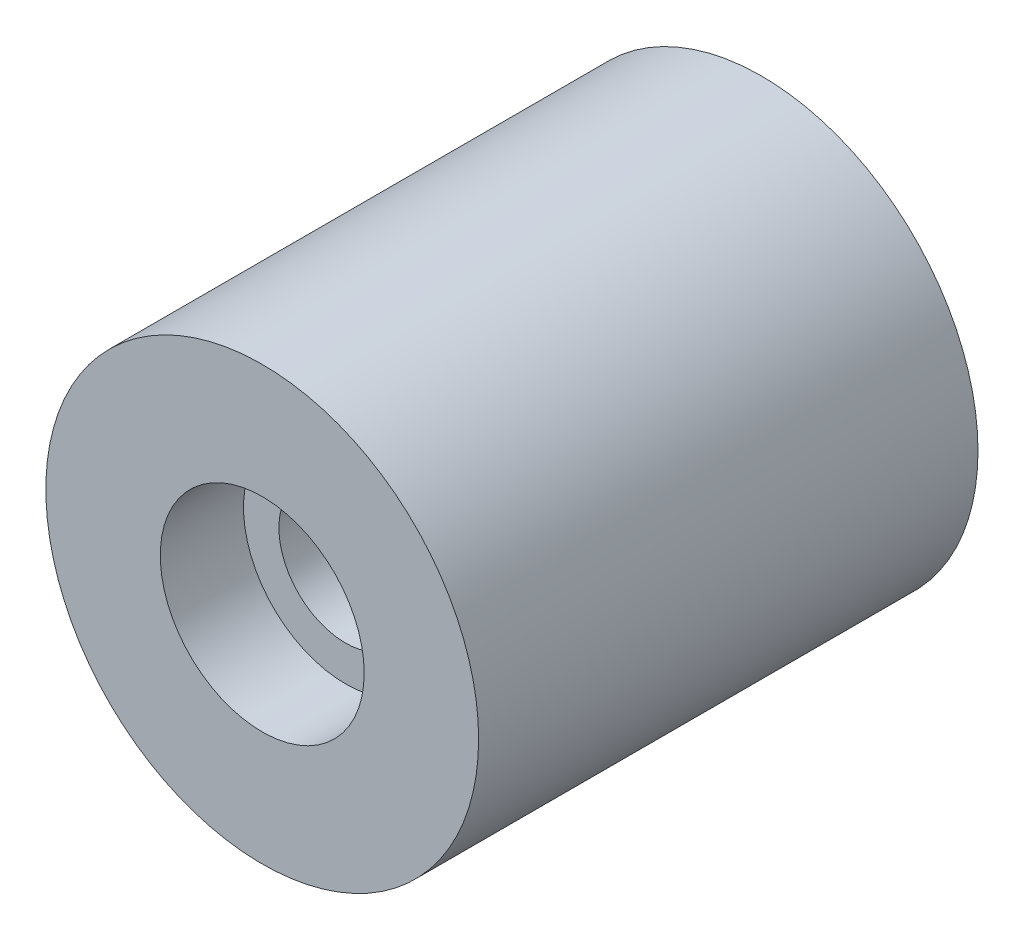
from build123d import *

# Parameters (mm, degrees)
BOSS_EXTRUDE1_DEPTH      = 7.5
BOSS_EXTRUDE1_DEPTH_BACK = 7.5
SKETCH1_R                = 6.5
SKETCH1_R_2              = 2
SKETCH2_R                = 3.0625
CUT_EXTRUDE1_DEPTH       = 2.5


with BuildPart() as part:
    # Sketch1 → Boss-Extrude1 (new, two sides: drawn at the far end of the back side and taken through both)
    with BuildSketch(Plane.XY.offset(13.5).offset(-BOSS_EXTRUDE1_DEPTH_BACK)):
        with Locations((15, 0)):
            Circle(SKETCH1_R)
        with Locations((15, 0)):
            Circle(SKETCH1_R_2, mode=Mode.SUBTRACT)
    extrude(amount=BOSS_EXTRUDE1_DEPTH + BOSS_EXTRUDE1_DEPTH_BACK)

    # Sketch2 → Cut-Extrude1 (cut)
    with BuildSketch(Plane.XY.offset(21)):
        with Locations((15, 0)):
            Circle(SKETCH2_R)
    cut_extrude1 = extrude(amount=-CUT_EXTRUDE1_DEPTH, mode=Mode.SUBTRACT)

    # Mirror1: Cut-Extrude1 across plane
    add(cut_extrude1.mirror(Plane.XY.offset(13.5)), mode=Mode.SUBTRACT)


solid = part.part
